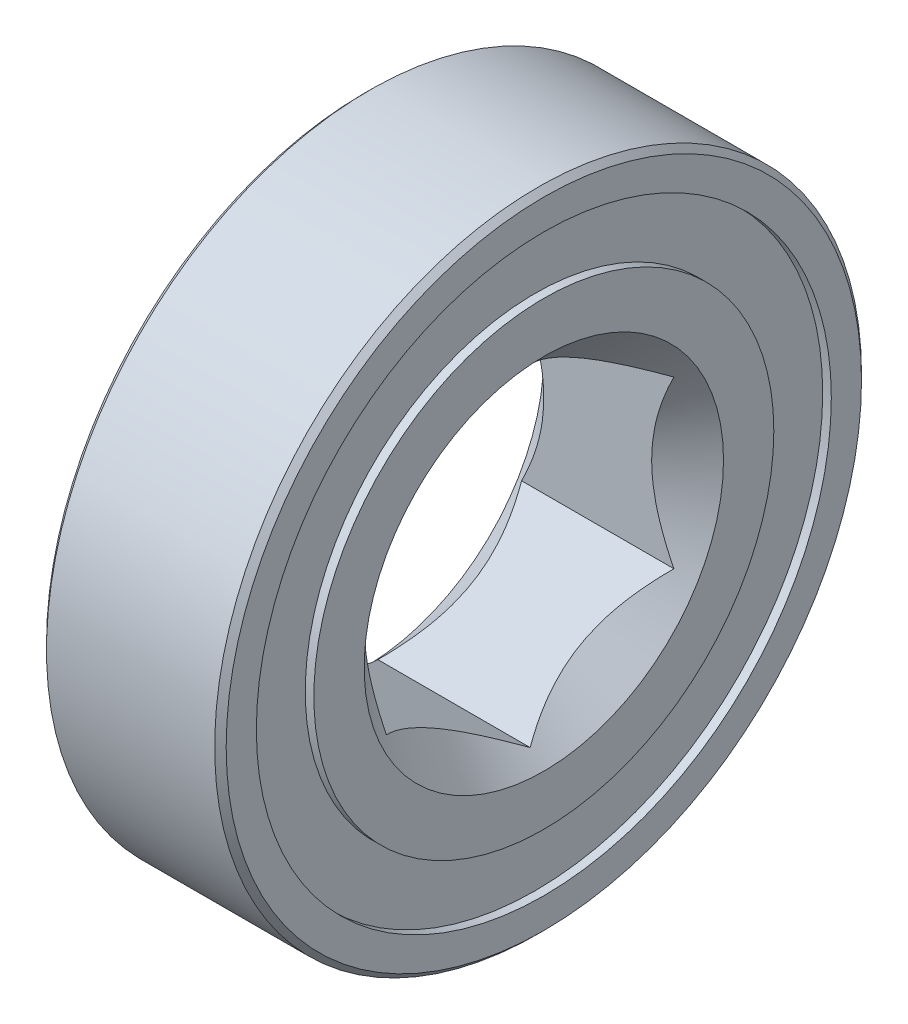
from build123d import *

# Parameters (mm, degrees)
CUT_EXTRUDE1_DEPTH = 22.708736000744032


with BuildPart() as part:
    # Sketch1 → Revolve1 (revolve)
    with BuildSketch(Plane.XY, mode=Mode.PRIVATE) as revolve1_sk:
        Polygon((0.254, 14.2875), (7.6835, 14.2875), (7.9375, 14.033499999999998), (7.9375, 12.7), (7.556499999999999, 12.7), (7.5565, 10.16), (7.9375, 10.16), (7.9375, 7.9374999999999964), (6.349999999999997, 6.349999999999998), (1.587500000000001, 6.3500000000000005), (0, 7.9375), (0, 10.16), (0.381, 10.16), (0.381, 12.7), (0, 12.7), (0, 14.033499999999998), align=None)
    revolve(revolve1_sk.sketch.rotate(Axis((0, 0, 0), (-1, 0, 0)), 90), axis=Axis((0, 0, 0), (-1, 0, 0)))

    # Sketch2 → Cut-Extrude1 (cut, through all)
    with BuildSketch(Plane(origin=(7.9375, 0, 0), x_dir=(0, 0, -1), z_dir=(1, 0, 0))):
        Polygon((-8.7e-16, 7.332348418708245), (-6.349999999999997, 3.6661742093541227), (-6.349999999999996, -3.666174209354121), (5.15e-15, -7.332348418708244), (6.349999999999999, -3.6661742093541214), (6.349999999999997, 3.6661742093541236), align=None)
    extrude(amount=-CUT_EXTRUDE1_DEPTH, mode=Mode.SUBTRACT)


solid = part.part
